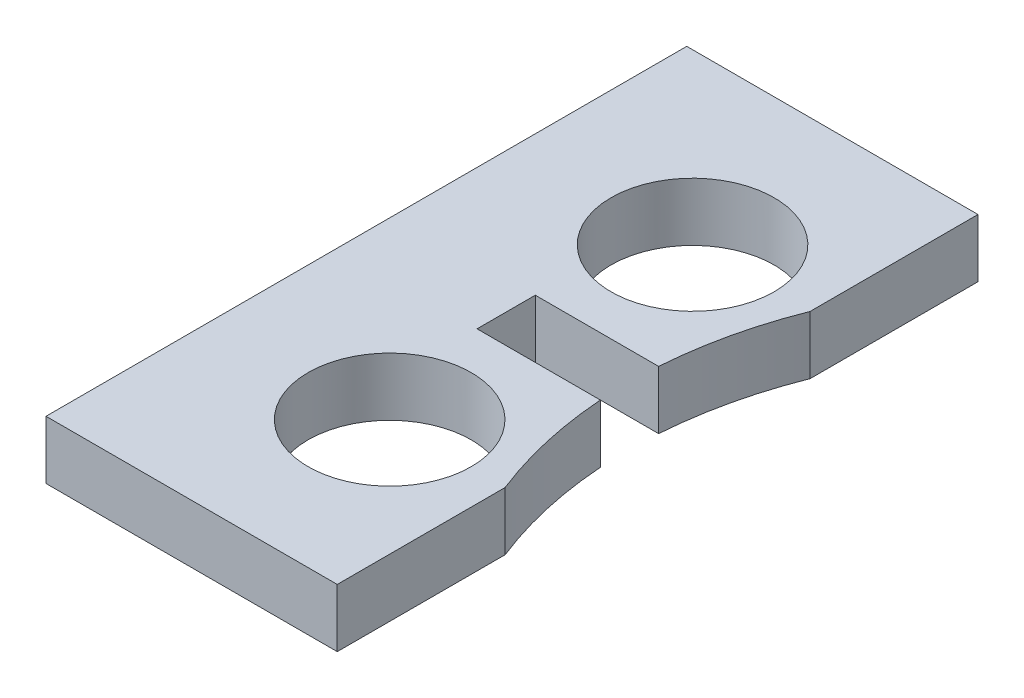
from build123d import *

# Parameters (mm, degrees)
SKETCH2_W                = 20
SKETCH2_H                = 5
BOSS_EXTRUDE2_DEPTH      = 25
BOSS_EXTRUDE3_DEPTH      = 5
BOSS_EXTRUDE3_DEPTH_BACK = 25
SKETCH3_W                = 5
SKETCH3_H                = 5
SKETCH4_W                = 25
SKETCH4_H                = 5
BOSS_EXTRUDE4_DEPTH      = 25
SKETCH5_R                = 7
CUT_EXTRUDE1_DEPTH       = 30
CUT_EXTRUDE2_DEPTH       = 10
SKETCH7_W                = 5
SKETCH7_H                = 5
BOSS_EXTRUDE5_DEPTH      = 7


with BuildPart() as part:
    # Sketch2 → Boss-Extrude2 (new body)
    with BuildSketch(Plane.XY):
        with Locations((15, 2.5)):
            Rectangle(SKETCH2_W, SKETCH2_H)
    extrude(amount=BOSS_EXTRUDE2_DEPTH)

    # Sketch3 → Boss-Extrude3 (add, two sides: drawn at the far end of the back side and taken through both)
    with BuildSketch(Plane(origin=(0, 0, 0), x_dir=(-1, 0, 0), z_dir=(0, 0, -1)).offset(-BOSS_EXTRUDE3_DEPTH_BACK)):
        with Locations((-2.5, 2.5)):
            Rectangle(SKETCH3_W, SKETCH3_H)
    extrude(amount=BOSS_EXTRUDE3_DEPTH + BOSS_EXTRUDE3_DEPTH_BACK)

    # Sketch4 → Boss-Extrude4 (add)
    with BuildSketch(Plane(origin=(0, 0, -5), x_dir=(-1, 0, 0), z_dir=(0, 0, -1))):
        with Locations((-12.5, 2.5)):
            Rectangle(SKETCH4_W, SKETCH4_H)
    extrude(amount=BOSS_EXTRUDE4_DEPTH)

    # Sketch5 → Cut-Extrude1 (cut)
    with BuildSketch(Plane(origin=(0, 5, 0), x_dir=(1, 0, 0), z_dir=(0, 1, 0))):
        with Locations(Location((15, -10.5, 0), (0, 0, 180))):
            Circle(SKETCH5_R)
        with Locations(Location((15, 15.5, 0), (0, 0, 180))):
            Circle(SKETCH5_R)
    extrude(amount=-CUT_EXTRUDE1_DEPTH, mode=Mode.SUBTRACT)

    # Sketch6 → Cut-Extrude2 (cut)
    with BuildSketch(Plane.XZ):
        with BuildLine():
            ThreePointArc((22.588137581, -5), (23.386954562, -10.385878866), (25, -15.586252328))
            Line((25, -15.586252328), (25, -5))
            Line((25, -5), (22.588137581, -5))
        make_face()
        with BuildLine():
            Line((25, 0), (25, 10.586252328))
            ThreePointArc((25, 10.586252328), (23.386954562, 5.385878866), (22.588137581, 0))
            Line((22.588137581, 0), (25, 0))
        make_face()
    extrude(amount=-CUT_EXTRUDE2_DEPTH, mode=Mode.SUBTRACT)

    # Sketch7 → Boss-Extrude5 (add)
    with BuildSketch(Plane(origin=(5, 0, 0), x_dir=(0, 0, -1), z_dir=(1, 0, 0))):
        with Locations((2.5, 2.5)):
            Rectangle(SKETCH7_W, SKETCH7_H)
    extrude(amount=BOSS_EXTRUDE5_DEPTH)


solid = part.part
